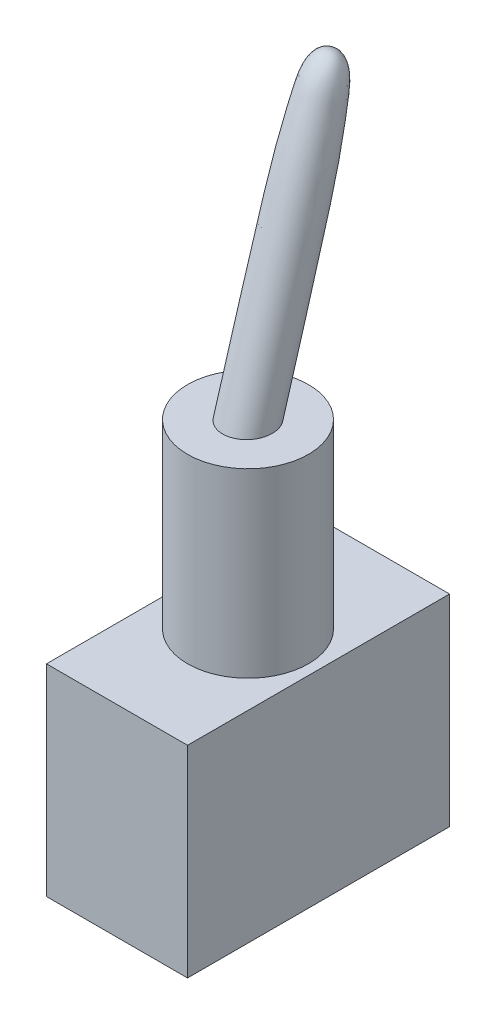
from build123d import *

# Parameters (mm, degrees)
SCHIZZO1_W                   = 7
SCHIZZO1_H                   = 13
ESTRUSIONE_ESTRUSIONE1_DEPTH = 10
SCHIZZO2_R                   = 3
ESTRUSIONE_ESTRUSIONE2_DEPTH = 9


with BuildPart() as part:
    # Schizzo1 → Estrusione-Estrusione1 (new body)
    with BuildSketch(Plane(origin=(0, 0, 0), x_dir=(1, 0, 0), z_dir=(0, 1, 0))):
        with Locations((3.5, 6.5)):
            Rectangle(SCHIZZO1_W, SCHIZZO1_H)
    extrude(amount=ESTRUSIONE_ESTRUSIONE1_DEPTH)

    # Schizzo2 → Estrusione-Estrusione2 (add)
    with BuildSketch(Plane(origin=(0, 10, 0), x_dir=(1, 0, 0), z_dir=(0, 1, 0))):
        with Locations(Location((3.5, 6.5, 0), (0, 0, 270))):
            Circle(SCHIZZO2_R)
    extrude(amount=ESTRUSIONE_ESTRUSIONE2_DEPTH)


with BuildPart() as body_2:
    # Schizzo5 → Rivoluzione1 (revolve)
    with BuildSketch(Plane(origin=(3.5, 0, 0), x_dir=(0, 0, -1), z_dir=(1, 0, 0))):
        with BuildLine():
            Line((6.5, 19), (10.604814586, 32.905769973))
            add(Edge.make_bspline(
                [(10.604814586, 32.905769973), (11.066183218, 32.769579551), (11.279530845, 31.932579848), (10.438498824, 28.112389995), (10.428508858, 28.059361062), (7.443952191, 17.948658713)],
                knots=[0, 0, 0, 0, 0.119714637, 0.219714637, 1, 1, 1, 1], degree=3))
            Line((7.443952191, 17.948658713), (6.5, 19))
        make_face()
    revolve(axis=Axis((3.5, 19, -6.5), (0, 0.9590871798695411, -0.28311089948974166)))


solid = Compound([part.part, body_2.part])
